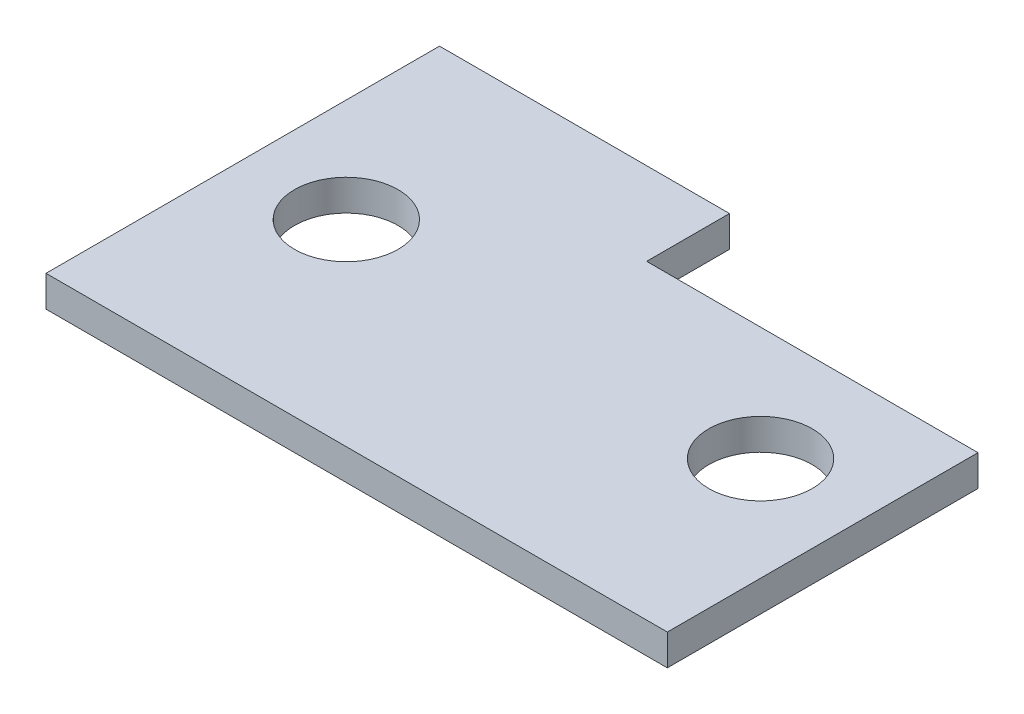
from build123d import *

# Parameters (mm, degrees)
EXTRUDE_1_DEPTH      = 30
EXTRUDE_1_DEPTH_BACK = 30
SKETCH_1_W           = 38
SKETCH_1_H           = 3
SKETCH_2_R           = 5
SKETCH_2_W           = 32
SKETCH_2_H           = 8
CUT_EXTRUDE_1_DEPTH  = 51.089919145


with BuildPart() as part:
    # Эскиз1 → Бобышка-Вытянуть1 (new, two sides: drawn at the far end of the back side and taken through both)
    with BuildSketch(Plane(origin=(0, 0, 0), x_dir=(0, 0, -1), z_dir=(1, 0, 0)).offset(-EXTRUDE_1_DEPTH_BACK)):
        with Locations((-21, 9.245966692)):
            Rectangle(SKETCH_1_W, SKETCH_1_H)
    extrude(amount=EXTRUDE_1_DEPTH + EXTRUDE_1_DEPTH_BACK)

    # Эскиз2 → Вырез-Вытянуть1 (cut, through all)
    with BuildSketch(Plane(origin=(0, 10.745966692, 0), x_dir=(1, 0, 0), z_dir=(0, 1, 0))):
        with Locations(Location((-20, -21, 0), (0, 0, 270))):
            Circle(SKETCH_2_R)
        with Locations(Location((20, -21, 0), (0, 0, 270))):
            Circle(SKETCH_2_R)
        with Locations((14, -6)):
            Rectangle(SKETCH_2_W, SKETCH_2_H)
    extrude(amount=-CUT_EXTRUDE_1_DEPTH, mode=Mode.SUBTRACT)


solid = part.part
